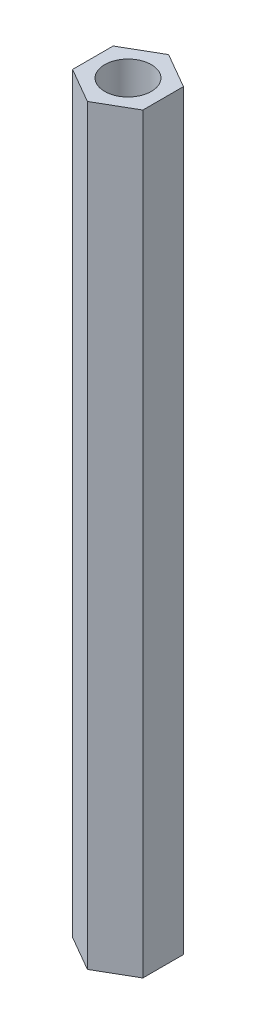
from build123d import *

# Parameters (mm, degrees)
SKETCH_1_R      = 1.55
EXTRUDE_1_DEPTH = 50


with BuildPart() as part:
    # 草图1 → 凸台-拉伸1 (new body)
    with BuildSketch(Plane(origin=(0, 0, 0), x_dir=(1, 0, 0), z_dir=(0, 1, 0))):
        Polygon((0, 2.7), (-2.33826859, 1.35), (-2.33826859, -1.35), (0, -2.7), (2.33826859, -1.35), (2.33826859, 1.35), align=None)
        with Locations(Location((0, 0, 0), (0, 0, 270))):
            Circle(SKETCH_1_R, mode=Mode.SUBTRACT)
    extrude(amount=EXTRUDE_1_DEPTH)


solid = part.part
